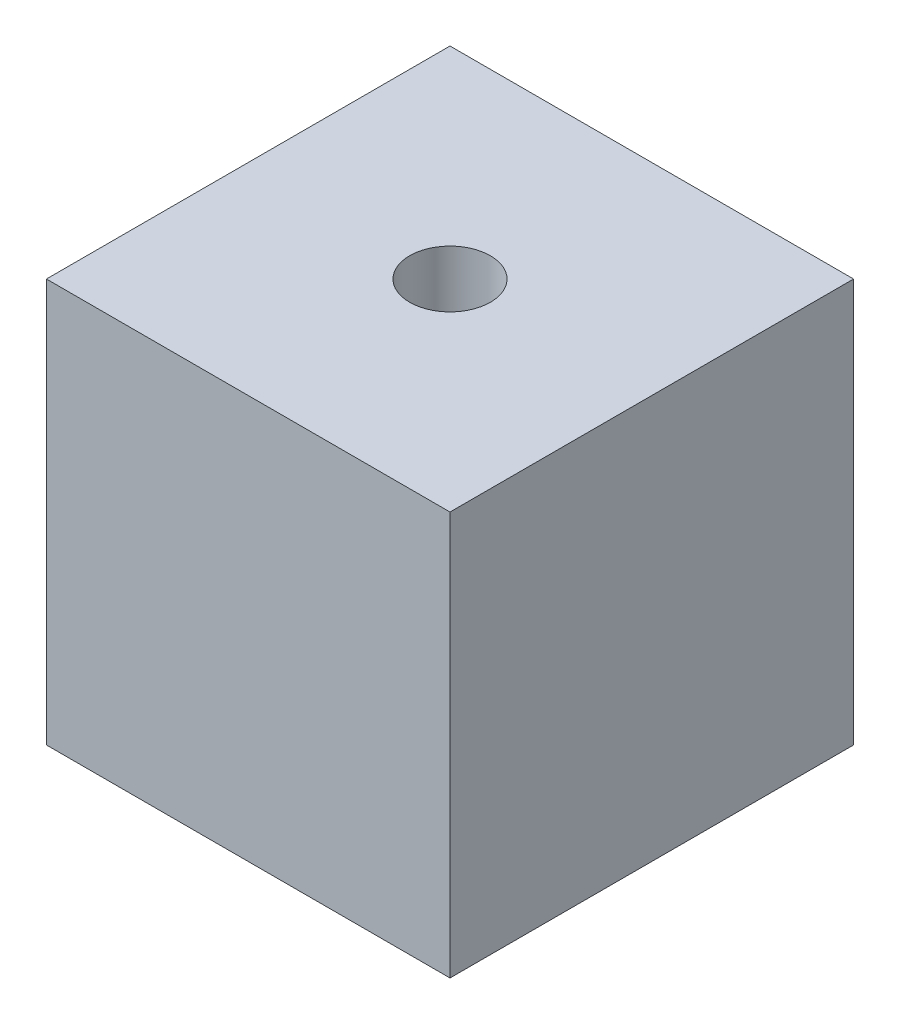
from build123d import *

# Parameters (mm, degrees)
SKETCH1_W           = 15
SKETCH1_H           = 15
BOSS_EXTRUDE1_DEPTH = 15
SKETCH2_R           = 1.5
CUT_EXTRUDE1_DEPTH  = 19.371173071


with BuildPart() as part:
    # Sketch1 → Boss-Extrude1 (new body)
    with BuildSketch(Plane(origin=(0, 0, 0), x_dir=(1, 0, 0), z_dir=(0, 1, 0))):
        Rectangle(SKETCH1_W, SKETCH1_H)
    extrude(amount=BOSS_EXTRUDE1_DEPTH)

    # Sketch2 → Cut-Extrude1 (cut, through all)
    with BuildSketch(Plane(origin=(0, 15, 0), x_dir=(-1, 0, 0), z_dir=(0, 1, 0))):
        with Locations(Location((0, 0, 0), (0, 0, 90))):
            Circle(SKETCH2_R)
    extrude(amount=-CUT_EXTRUDE1_DEPTH, mode=Mode.SUBTRACT)


solid = part.part
